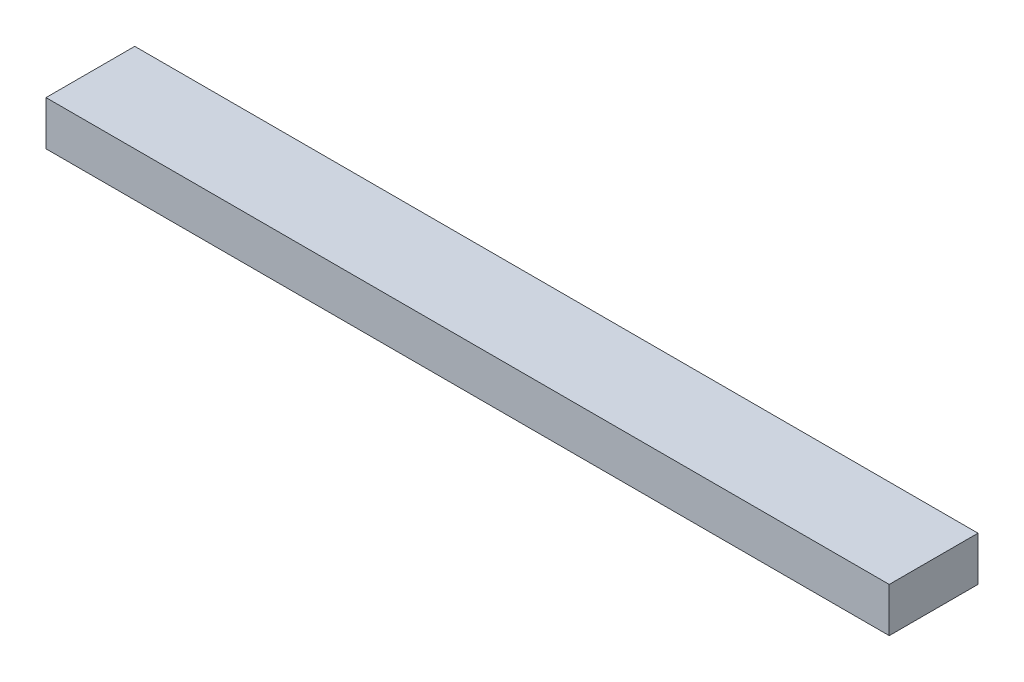
from build123d import *

# Parameters (mm, degrees)
SKETCH1_W           = 241.3
SKETCH1_H           = 25.4
BOSS_EXTRUDE1_DEPTH = 12.7


with BuildPart() as part:
    # Sketch1 → Boss-Extrude1 (new body)
    with BuildSketch(Plane(origin=(0, 0, 0), x_dir=(1, 0, 0), z_dir=(0, 1, 0))):
        with Locations((66.709413196, 16.24401611)):
            Rectangle(SKETCH1_W, SKETCH1_H)
    extrude(amount=BOSS_EXTRUDE1_DEPTH)


solid = part.part
